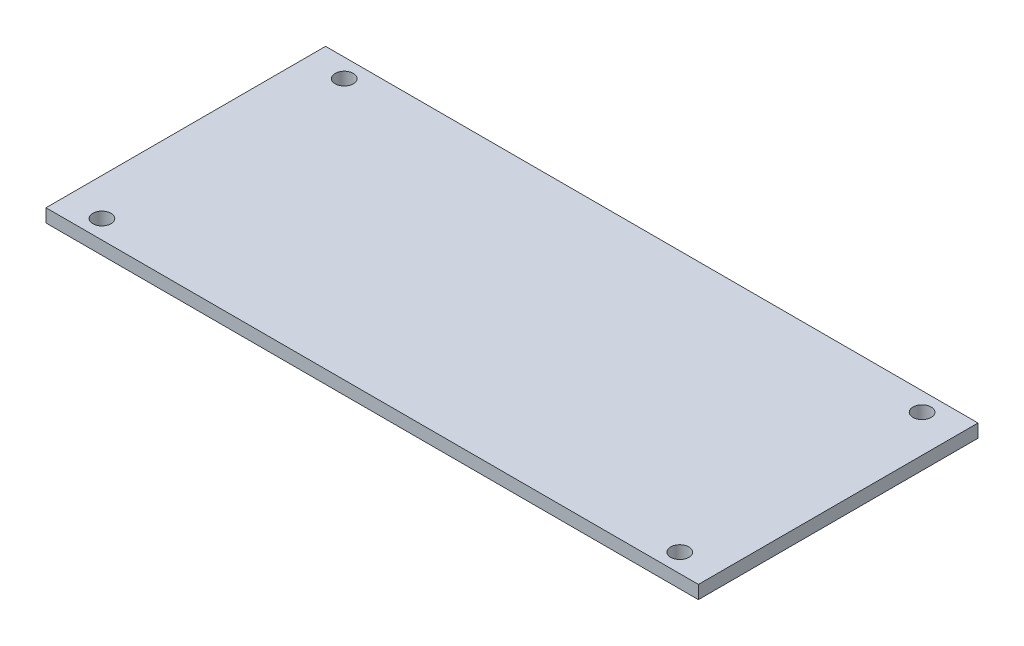
from build123d import *

# Parameters (mm, degrees)
SKETCH3_W           = 70
SKETCH3_H           = 30
SKETCH3_R           = 0.975
BOSS_EXTRUDE1_DEPTH = 1.42


with BuildPart() as part:
    # Sketch3 → Boss-Extrude1 (new body)
    with BuildSketch(Plane(origin=(0, 0, 0), x_dir=(1, 0, 0), z_dir=(0, 1, 0))):
        Rectangle(SKETCH3_W, SKETCH3_H)
        with Locations(Location((-31, 13, 0), (0, 0, 90))):
            Circle(SKETCH3_R, mode=Mode.SUBTRACT)
        with Locations(Location((31, 13, 0), (0, 0, 90))):
            Circle(SKETCH3_R, mode=Mode.SUBTRACT)
        with Locations(Location((31, -13, 0), (0, 0, 90))):
            Circle(SKETCH3_R, mode=Mode.SUBTRACT)
        with Locations(Location((-31, -13, 0), (0, 0, 90))):
            Circle(SKETCH3_R, mode=Mode.SUBTRACT)
    extrude(amount=BOSS_EXTRUDE1_DEPTH)


solid = part.part
